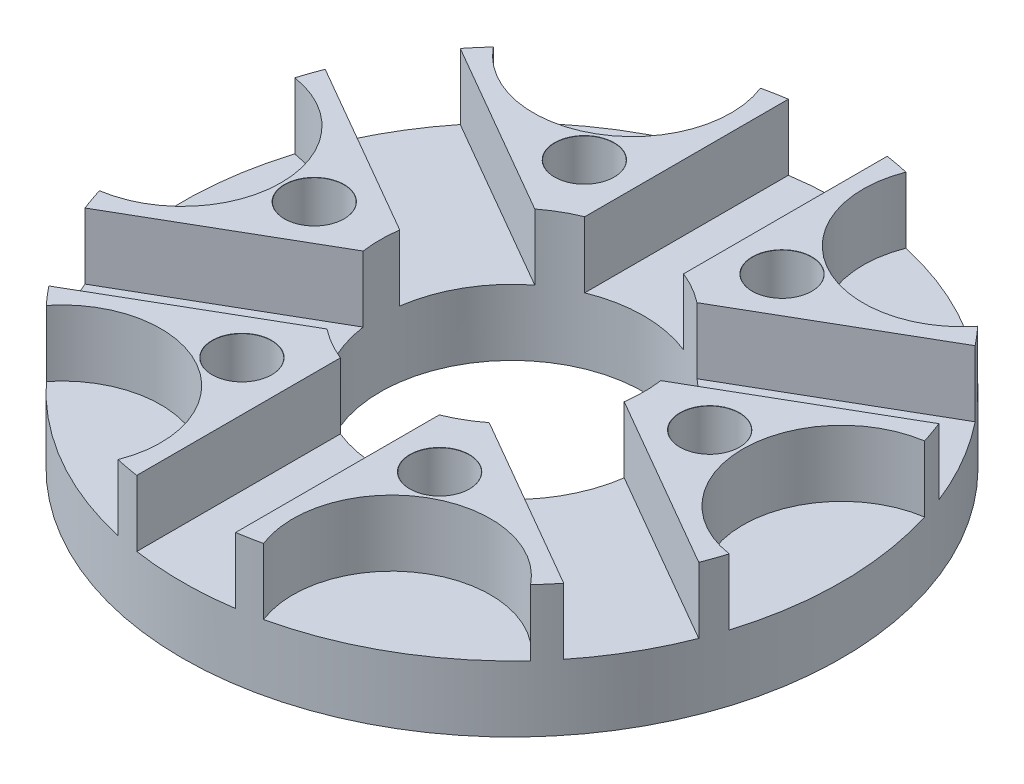
from build123d import *

# Parameters (mm, degrees)
SKETCH1_R           = 50
BOSS_EXTRUDE1_DEPTH = 10
SKETCH2_R           = 20
CUT_EXTRUDE1_DEPTH  = 74.484692283
CUT_EXTRUDE2_DEPTH  = 10
CUT_EXTRUDE3_DEPTH  = 10
CIRPATTERN1_COUNT   = 6
CIRPATTERN2_COUNT   = 6


with BuildPart() as part:
    # Sketch1 → Boss-Extrude1 (new, symmetric)
    with BuildSketch(Plane(origin=(0, 0, 0), x_dir=(1, 0, 0), z_dir=(0, 1, 0))):
        with Locations(Location((0, 0, 0), (0, 0, 270))):
            Circle(SKETCH1_R)
    extrude(amount=BOSS_EXTRUDE1_DEPTH, both=True)

    # Sketch2 → Cut-Extrude1 (cut, through all)
    with BuildSketch(Plane(origin=(0, 10, 0), x_dir=(1, 0, 0), z_dir=(0, 1, 0))):
        with Locations(Location((0, 0, 0), (0, 0, 270))):
            Circle(SKETCH2_R)
    extrude(amount=-CUT_EXTRUDE1_DEPTH, mode=Mode.SUBTRACT)

    # Sketch3 → Cut-Extrude2 (cut)
    with BuildSketch(Plane(origin=(0, 10, 0), x_dir=(1, 0, 0), z_dir=(0, 1, 0))):
        with BuildLine():
            Line((-7.5, 49.434299833), (-7.5, 18.540496218))
            ThreePointArc((-7.5, 18.540496218), (0, 20), (7.5, 18.540496218))
            Line((7.5, 18.540496218), (7.5, 49.434299833))
            ThreePointArc((7.5, 49.434299833), (0, 50), (-7.5, 49.434299833))
        make_face()
        with BuildLine():
            Line((39.061359474, 31.212340445), (12.306540723, 15.765438637))
            ThreePointArc((12.306540723, 15.765438637), (17.320508076, 10), (19.806540723, 2.77505758))
            Line((19.806540723, 2.77505758), (46.561359474, 18.221959388))
            ThreePointArc((46.561359474, 18.221959388), (43.301270189, 25), (39.061359474, 31.212340445))
        make_face()
        with BuildLine():
            Line((46.561359474, -18.221959388), (19.806540723, -2.77505758))
            ThreePointArc((19.806540723, -2.77505758), (17.320508076, -10), (12.306540723, -15.765438637))
            Line((12.306540723, -15.765438637), (39.061359474, -31.212340445))
            ThreePointArc((39.061359474, -31.212340445), (43.301270189, -25), (46.561359474, -18.221959388))
        make_face()
        with BuildLine():
            Line((7.5, -49.434299833), (7.5, -18.540496218))
            ThreePointArc((7.5, -18.540496218), (0, -20), (-7.5, -18.540496218))
            Line((-7.5, -18.540496218), (-7.5, -49.434299833))
            ThreePointArc((-7.5, -49.434299833), (0, -50), (7.5, -49.434299833))
        make_face()
        with BuildLine():
            Line((-39.061359474, -31.212340445), (-12.306540723, -15.765438637))
            ThreePointArc((-12.306540723, -15.765438637), (-17.320508076, -10), (-19.806540723, -2.77505758))
            Line((-19.806540723, -2.77505758), (-46.561359474, -18.221959388))
            ThreePointArc((-46.561359474, -18.221959388), (-43.301270189, -25), (-39.061359474, -31.212340445))
        make_face()
        with BuildLine():
            Line((-46.561359474, 18.221959388), (-19.806540723, 2.77505758))
            ThreePointArc((-19.806540723, 2.77505758), (-17.320508076, 10), (-12.306540723, 15.765438637))
            Line((-12.306540723, 15.765438637), (-39.061359474, 31.212340445))
            ThreePointArc((-39.061359474, 31.212340445), (-43.301270189, 25), (-46.561359474, 18.221959388))
        make_face()
    extrude(amount=-CUT_EXTRUDE2_DEPTH, mode=Mode.SUBTRACT)

    # Sketch4 → Cut-Extrude3 (cut)
    with BuildSketch(Plane(origin=(0, 10, 0), x_dir=(1, 0, 0), z_dir=(0, 1, 0))):
        with BuildLine():
            ThreePointArc((11, 48.774993593), (17.480362162, 30.322218565), (36.696416757, 33.961345633))
            ThreePointArc((36.696416757, 33.961345633), (24.971945946, 43.317455092), (11, 48.774993593))
        make_face()
    cut_extrude3 = extrude(amount=-CUT_EXTRUDE3_DEPTH, mode=Mode.SUBTRACT)

    # Sketch6 → Tap Drill for M10x1.0 Tap1 (revolve, cut)
    with BuildSketch(Plane(origin=(30, 10, 0), x_dir=(0, 0, 1), z_dir=(1, 0, 0))):
        Polygon((0, 0), (0, 72.703872786), (4.5, 70), (4.5, 0.025), (4.525, 0), align=None)
    tap_drill_for_m10x1_0_tap1 = revolve(axis=Axis((30, 16.35, 0), (0, -1, 0)), mode=Mode.SUBTRACT)

    # CirPattern1: Tap Drill for M10x1.0 Tap1 ×6 about axis
    cirpattern1_axis = Axis((0, 0, 0), (0, 1, 0))
    for i in range(1, CIRPATTERN1_COUNT):
        add(tap_drill_for_m10x1_0_tap1.rotate(cirpattern1_axis, i * 360 / CIRPATTERN1_COUNT), mode=Mode.SUBTRACT)

    # CirPattern2: Cut-Extrude3 ×6 about axis
    cirpattern2_axis = Axis((0, 0, 0), (0, 1, 0))
    for i in range(1, CIRPATTERN2_COUNT):
        add(cut_extrude3.rotate(cirpattern2_axis, i * 360 / CIRPATTERN2_COUNT), mode=Mode.SUBTRACT)


solid = part.part
